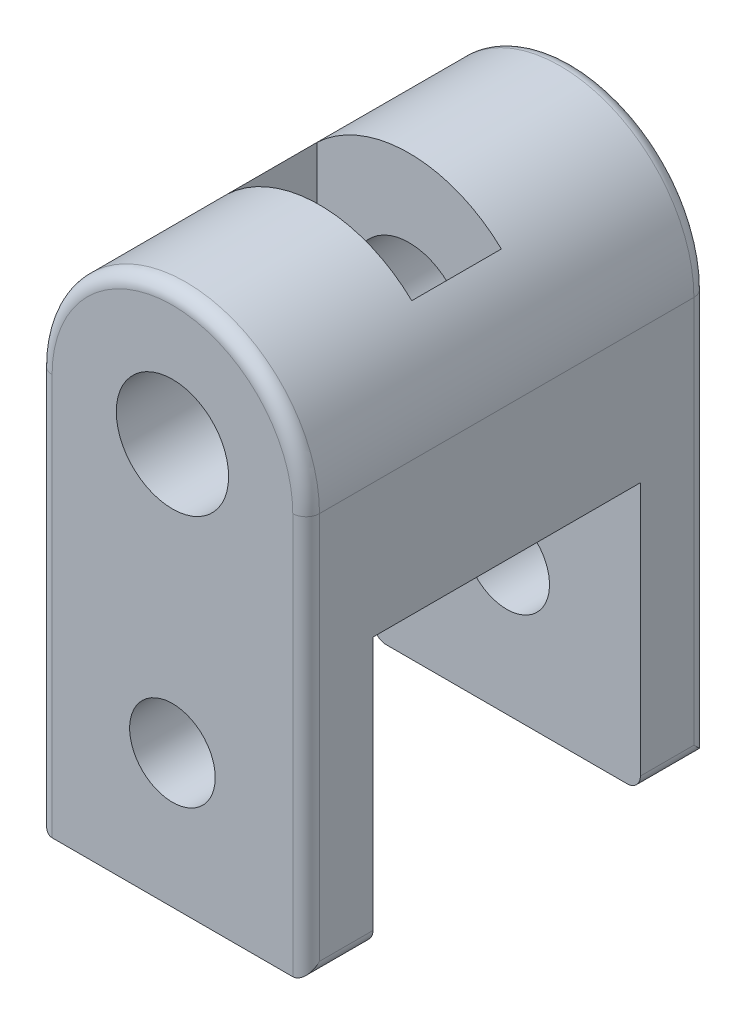
from build123d import *
from build123d.topology import SkipClean

# Parameters (mm, degrees)
SKETCH2_R           = 4.200000000000002
SKETCH2_R_2         = 3.2
BOSS_EXTRUDE2_DEPTH = 5
BOSS_EXTRUDE3_START = 20
BOSS_EXTRUDE3_DEPTH = 20
BOSS_EXTRUDE4_START = 6
SKETCH4_R           = 4.200000000000002
BOSS_EXTRUDE4_DEPTH = 6
BOSS_EXTRUDE5_START = 5
SKETCH5_R           = 3.2000000000000006
SKETCH5_R_2         = 4.200000000000001
BOSS_EXTRUDE5_DEPTH = 5
SKETCH6_R           = 4.200000000000002
BOSS_EXTRUDE6_DEPTH = 7.3
FILLET1_R           = 1


with BuildPart() as part:
    # Sketch2 → Boss-Extrude2 (new body)
    with BuildSketch(Plane.XY):
        with BuildLine():
            Line((-10.002730808209856, -10.002730808209863), (9.997269191790144, -10.002730808209856))
            Line((9.997269191790144, -10.002730808209856), (9.997269191790144, 19.99726919179014))
            ThreePointArc((9.997269191790144, 19.99726919179014), (-0.00273080820985792, 29.99726919179014), (-10.002730808209856, 19.997269191790135))
            Line((-10.002730808209856, 19.997269191790135), (-10.002730808209856, -10.002730808209863))
        make_face()
        with Locations((-0.00273080820985608, 19.99726919179014)):
            Circle(SKETCH2_R, mode=Mode.SUBTRACT)
        with Locations((-0.00273080820986128, -0.00273080820986128)):
            Circle(SKETCH2_R_2, mode=Mode.SUBTRACT)
    extrude(amount=BOSS_EXTRUDE2_DEPTH)

    # Sketch3 → Boss-Extrude3 (add)
    with BuildSketch(Plane(origin=(0, 0, 0), x_dir=(-1, 0, 0), z_dir=(0, 0, -1)).offset(BOSS_EXTRUDE3_START)):
        with BuildLine():
            Line((6.9027308082098555, 19.298146779896605), (6.9027308082098555, 27.235362863469167))
            ThreePointArc((6.9027308082098555, 27.235362863469167), (9.195118963634973, 23.934273128796043), (10.002730808209856, 19.99726919179014))
            Line((10.002730808209856, 19.99726919179014), (10.002730808209868, 9.997269191790137))
            Line((10.002730808209868, 9.997269191790137), (-9.997269191790144, 9.997269191790139))
            Line((-9.997269191790144, 9.997269191790139), (-9.997269191790146, 19.99726919179014))
            ThreePointArc((-9.997269191790146, 19.99726919179014), (-9.189657347215263, 23.934273128796043), (-6.897269191790147, 27.235362863469163))
            Line((-6.897269191790147, 27.235362863469163), (-6.897269191790146, 21.118127792576228))
            Line((-6.897269191790146, 21.118127792576228), (-6.897269191790146, 16.01355233438172))
            Line((-6.897269191790146, 16.01355233438172), (0.00273080820985521, 12.029835476973302))
            Line((0.00273080820985521, 12.029835476973302), (6.9027308082098555, 16.013552334381725))
            Line((6.9027308082098555, 16.013552334381725), (6.9027308082098555, 19.298146779896605))
        make_face()
    extrude(amount=-BOSS_EXTRUDE3_DEPTH)

    # Sketch4 → Boss-Extrude4 (add)
    with SkipClean():  # the faces are left unmerged after this step: merging them gives an invalid solid
        with BuildSketch(Plane(origin=(0, 0, 0), x_dir=(-1, 0, 0), z_dir=(0, 0, -1)).offset(BOSS_EXTRUDE4_START)):
            with BuildLine():
                Line((6.9027308082098555, 16.013552334381725), (6.902730808209854, 27.235362863469167))
                ThreePointArc((6.902730808209854, 27.235362863469167), (0.00273080820985225, 29.99726919179014), (-6.897269191790148, 27.235362863469163))
                Line((-6.897269191790148, 27.235362863469163), (-6.897269191790146, 16.01355233438172))
                Line((-6.897269191790146, 16.01355233438172), (0.00273080820985521, 12.029835476973302))
                Line((0.00273080820985521, 12.029835476973302), (6.9027308082098555, 16.013552334381725))
            make_face()
            with Locations((0.00273080820985608, 19.99726919179014)):
                Circle(SKETCH4_R, mode=Mode.SUBTRACT)
        extrude(amount=-BOSS_EXTRUDE4_DEPTH)

    # Sketch5 → Boss-Extrude5 (add)
    # profile 1 of 3: a face of its own
    with SkipClean():  # the faces are left unmerged after this step: merging them gives an invalid solid
        with BuildSketch(Plane(origin=(0, 0, -20), x_dir=(-1, 0, 0), z_dir=(0, 0, -1)).offset(BOSS_EXTRUDE5_START)):
            with BuildLine():
                Line((6.9027308082098555, 16.013552334381725), (0.00273080820985521, 12.029835476973302))
                Line((0.00273080820985521, 12.029835476973302), (-6.897269191790146, 16.01355233438172))
                Line((-6.897269191790146, 16.01355233438172), (-6.897269191790149, 27.235362863469163))
                ThreePointArc((-6.897269191790149, 27.235362863469163), (-9.189657347215263, 23.934273128796043), (-9.997269191790146, 19.99726919179014))
                Line((-9.997269191790146, 19.99726919179014), (-9.997269191790144, 9.997269191790139))
                Line((-9.997269191790144, 9.997269191790139), (10.002730808209868, 9.997269191790137))
                Line((10.002730808209868, 9.997269191790137), (10.002730808209856, 19.99726919179014))
                ThreePointArc((10.002730808209856, 19.99726919179014), (9.195118963634973, 23.934273128796043), (6.9027308082098555, 27.235362863469167))
                Line((6.9027308082098555, 27.235362863469167), (6.9027308082098555, 16.013552334381725))
            make_face()
        # profile 2 of 3: a face of its own
        with BuildSketch(Plane(origin=(0, 0, -20), x_dir=(-1, 0, 0), z_dir=(0, 0, -1)).offset(BOSS_EXTRUDE5_START)):
            Polygon((10.00273080820987, 9.997269191790137), (-9.997269191790144, 9.997269191790139), (-9.997269191790142, -10.002730808209861), (10.002730808209861, -10.002730808209861), align=None)
            with Locations(Location((0.00273080820986128, -0.00273080820986128, 0), (0, 0, 180))):
                Circle(SKETCH5_R, mode=Mode.SUBTRACT)
        # profile 3 of 3: a face of its own
        with BuildSketch(Plane(origin=(0, 0, -20), x_dir=(-1, 0, 0), z_dir=(0, 0, -1)).offset(BOSS_EXTRUDE5_START)):
            with BuildLine():
                ThreePointArc((6.902730808209858, 27.235362863469167), (0.00273080820985499, 29.99726919179014), (-6.897269191790148, 27.235362863469163))
                Line((-6.897269191790149, 27.235362863469163), (-6.897269191790146, 16.01355233438172))
                Line((-6.897269191790146, 16.01355233438172), (0.00273080820985521, 12.029835476973302))
                Line((0.00273080820985516, 12.029835476973302), (6.9027308082098555, 16.013552334381725))
                Line((6.9027308082098555, 16.013552334381725), (6.9027308082098555, 27.235362863469167))
            make_face()
            with Locations((0.00273080820985608, 19.99726919179014)):
                Circle(SKETCH5_R_2, mode=Mode.SUBTRACT)
        extrude(amount=-BOSS_EXTRUDE5_DEPTH)

    # Sketch6 → Boss-Extrude6 (add)
    with SkipClean():  # the faces are left unmerged after this step: merging them gives an invalid solid
        with BuildSketch(Plane.XY.offset(-20)):
            with BuildLine():
                Line((-0.00273080820985521, 12.029835476973302), (6.897269191790146, 16.01355233438172))
                Line((6.897269191790146, 16.01355233438172), (6.897269191790149, 27.235362863469163))
                ThreePointArc((6.897269191790149, 27.235362863469163), (-0.00273080820985102, 29.99726919179014), (-6.9027308082098555, 27.23536286346917))
                Line((-6.9027308082098555, 27.23536286346917), (-6.9027308082098555, 16.013552334381725))
                Line((-6.9027308082098555, 16.013552334381725), (-0.00273080820985521, 12.029835476973302))
            make_face()
            with Locations(Location((-0.00273080820985608, 19.99726919179014, 0), (0, 0, 180))):
                Circle(SKETCH6_R, mode=Mode.SUBTRACT)
        extrude(amount=BOSS_EXTRUDE6_DEPTH)

    # Fillet1
    fillet1_edges = [part.edges().sort_by_distance(p)[0] for p in [
        (9.997269191790144, 4.99726919179014, 5),
        (-0.00273080820985721, 29.99726919179014, 5),
        (-10.002730808209856, 4.997269191790135, 5),
        (-10.002730808209861, -10.002730808209861, -22.5),
        (9.997269191790142, -10.002730808209861, -22.5),
        (-10.002730808209858, 4.997269191790139, -25),
        (-0.00273080820987453, 29.99726919179015, -25),
        (9.997269191790144, 4.997269191790139, -25),
        (9.997269191790144, -10.002730808209856, 2.5),
        (-10.002730808209856, -10.002730808209863, 2.5),
    ]]
    fillet(fillet1_edges, radius=FILLET1_R)


solid = part.part
